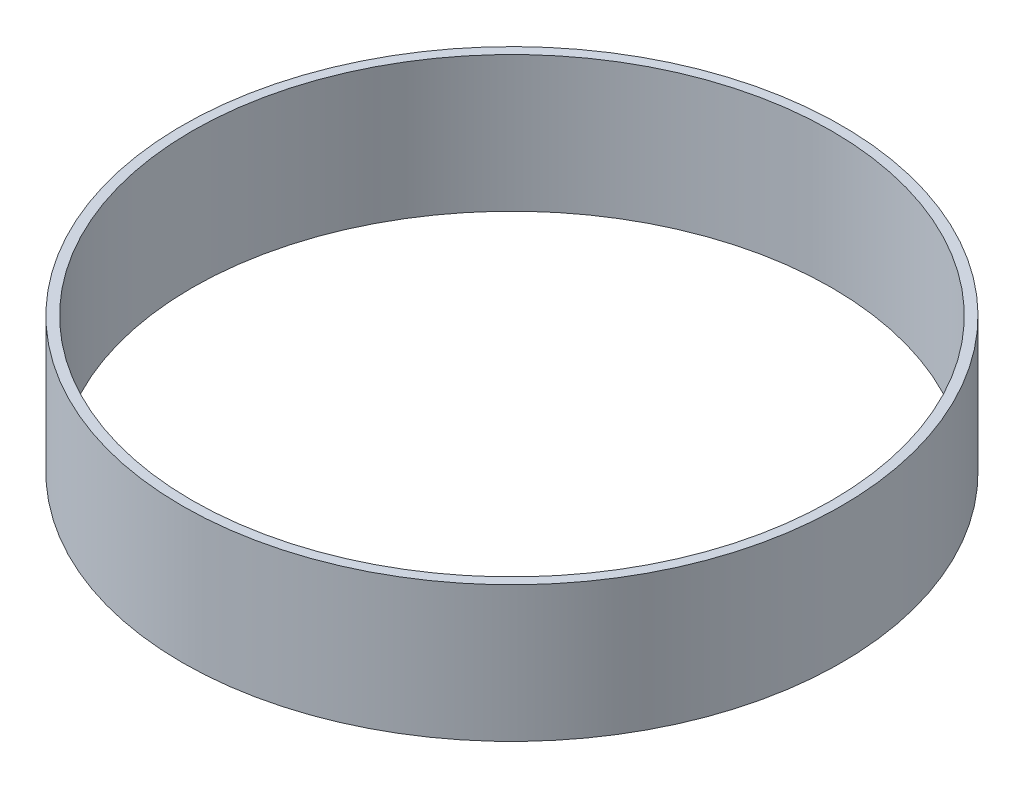
from build123d import *

# Parameters (mm, degrees)
SKETCH1_W = 1
SKETCH1_H = 14


with BuildPart() as part:
    # Sketch1 → Revolve1 (revolve)
    with BuildSketch(Plane.XY, mode=Mode.PRIVATE) as revolve1_sk:
        with Locations((-33.5, 0)):
            Rectangle(SKETCH1_W, SKETCH1_H)
    revolve(revolve1_sk.sketch.rotate(Axis((0, 0, 0), (0, -1, 0)), 270), axis=Axis((0, 0, 0), (0, -1, 0)))


solid = part.part
